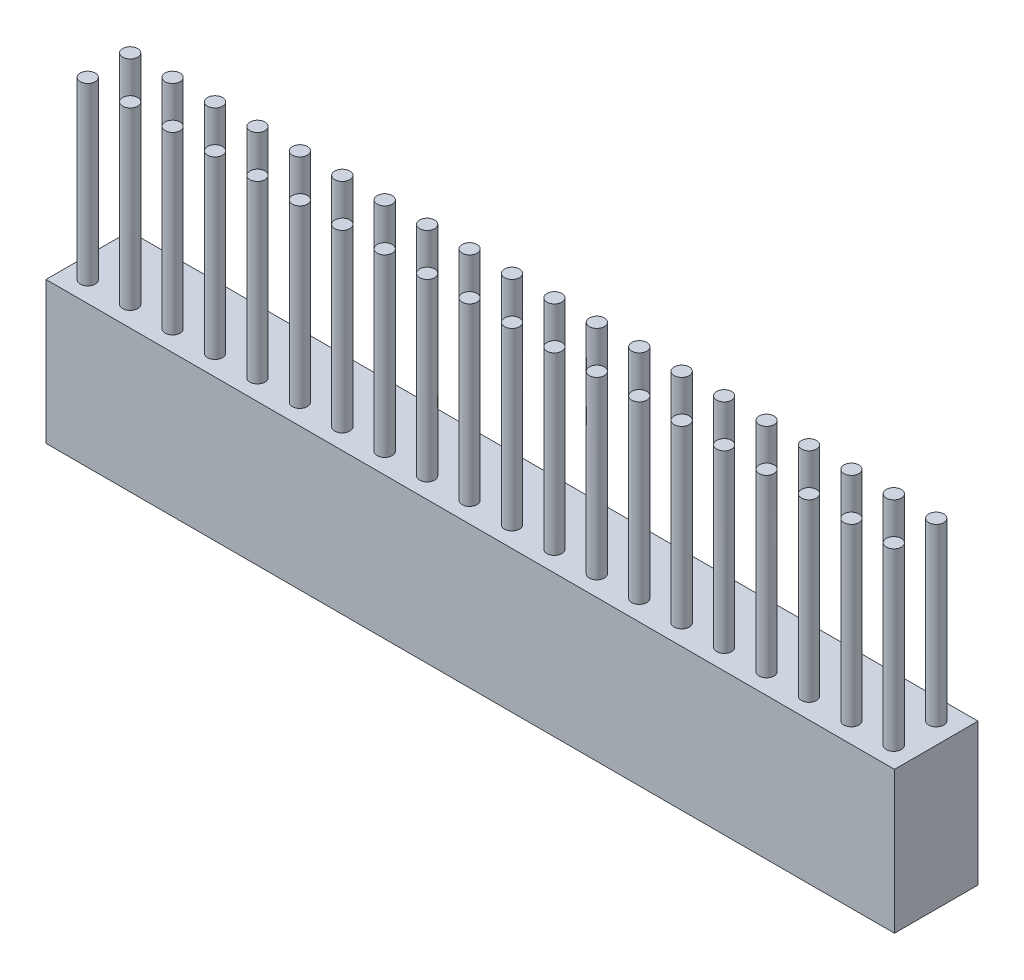
from build123d import *

# Parameters (mm, degrees)
SKETCH1_W           = 50.8
SKETCH1_H           = 5
BOSS_EXTRUDE1_DEPTH = 8.5
SKETCH2_R           = 0.449828919
BOSS_EXTRUDE2_DEPTH = 10.5
SKETCH3_W           = 1.27
SKETCH3_H           = 1.27
CUT_EXTRUDE1_DEPTH  = 5


with BuildPart() as part:
    # Sketch1 → Boss-Extrude1 (new body)
    with BuildSketch(Plane(origin=(0, 0, 0), x_dir=(1, 0, 0), z_dir=(0, 1, 0))):
        Rectangle(SKETCH1_W, SKETCH1_H)
    extrude(amount=BOSS_EXTRUDE1_DEPTH)

    # Sketch2 → Boss-Extrude2 (add)
    with BuildSketch(Plane(origin=(0, 8.5, 0), x_dir=(1, 0, 0), z_dir=(0, 1, 0))):
        with Locations(Location((-24.13, 1.27, 0), (0, 0, 90))):
            Circle(SKETCH2_R)
        with Locations(Location((-21.59, 1.27, 0), (0, 0, 90))):
            Circle(SKETCH2_R)
        with Locations(Location((-19.05, 1.27, 0), (0, 0, 90))):
            Circle(SKETCH2_R)
        with Locations(Location((-16.51, 1.27, 0), (0, 0, 90))):
            Circle(SKETCH2_R)
        with Locations(Location((-13.97, 1.27, 0), (0, 0, 90))):
            Circle(SKETCH2_R)
        with Locations(Location((-11.43, 1.27, 0), (0, 0, 90))):
            Circle(SKETCH2_R)
        with Locations(Location((-8.89, 1.27, 0), (0, 0, 90))):
            Circle(SKETCH2_R)
        with Locations(Location((-6.35, 1.27, 0), (0, 0, 90))):
            Circle(SKETCH2_R)
        with Locations(Location((-3.81, 1.27, 0), (0, 0, 90))):
            Circle(SKETCH2_R)
        with Locations(Location((-1.27, 1.27, 0), (0, 0, 90))):
            Circle(SKETCH2_R)
        with Locations(Location((1.27, 1.27, 0), (0, 0, 90))):
            Circle(SKETCH2_R)
        with Locations(Location((3.81, 1.27, 0), (0, 0, 90))):
            Circle(SKETCH2_R)
        with Locations(Location((6.35, 1.27, 0), (0, 0, 90))):
            Circle(SKETCH2_R)
        with Locations(Location((8.89, 1.27, 0), (0, 0, 90))):
            Circle(SKETCH2_R)
        with Locations(Location((11.43, 1.27, 0), (0, 0, 90))):
            Circle(SKETCH2_R)
        with Locations(Location((13.97, 1.27, 0), (0, 0, 90))):
            Circle(SKETCH2_R)
        with Locations(Location((16.51, 1.27, 0), (0, 0, 90))):
            Circle(SKETCH2_R)
        with Locations(Location((19.05, 1.27, 0), (0, 0, 90))):
            Circle(SKETCH2_R)
        with Locations(Location((21.59, 1.27, 0), (0, 0, 90))):
            Circle(SKETCH2_R)
        with Locations(Location((24.13, 1.27, 0), (0, 0, 90))):
            Circle(SKETCH2_R)
        with Locations(Location((-21.59, -1.27, 0), (0, 0, 90))):
            Circle(SKETCH2_R)
        with Locations(Location((-19.05, -1.27, 0), (0, 0, 90))):
            Circle(SKETCH2_R)
        with Locations(Location((-16.51, -1.27, 0), (0, 0, 90))):
            Circle(SKETCH2_R)
        with Locations(Location((-13.97, -1.27, 0), (0, 0, 90))):
            Circle(SKETCH2_R)
        with Locations(Location((-11.43, -1.27, 0), (0, 0, 90))):
            Circle(SKETCH2_R)
        with Locations(Location((-8.89, -1.27, 0), (0, 0, 90))):
            Circle(SKETCH2_R)
        with Locations(Location((-6.35, -1.27, 0), (0, 0, 90))):
            Circle(SKETCH2_R)
        with Locations(Location((-3.81, -1.27, 0), (0, 0, 90))):
            Circle(SKETCH2_R)
        with Locations(Location((-1.27, -1.27, 0), (0, 0, 90))):
            Circle(SKETCH2_R)
        with Locations(Location((1.27, -1.27, 0), (0, 0, 90))):
            Circle(SKETCH2_R)
        with Locations(Location((3.81, -1.27, 0), (0, 0, 90))):
            Circle(SKETCH2_R)
        with Locations(Location((6.35, -1.27, 0), (0, 0, 90))):
            Circle(SKETCH2_R)
        with Locations(Location((8.89, -1.27, 0), (0, 0, 90))):
            Circle(SKETCH2_R)
        with Locations(Location((11.43, -1.27, 0), (0, 0, 90))):
            Circle(SKETCH2_R)
        with Locations(Location((13.97, -1.27, 0), (0, 0, 90))):
            Circle(SKETCH2_R)
        with Locations(Location((16.51, -1.27, 0), (0, 0, 90))):
            Circle(SKETCH2_R)
        with Locations(Location((19.05, -1.27, 0), (0, 0, 90))):
            Circle(SKETCH2_R)
        with Locations(Location((21.59, -1.27, 0), (0, 0, 90))):
            Circle(SKETCH2_R)
        with Locations(Location((24.13, -1.27, 0), (0, 0, 90))):
            Circle(SKETCH2_R)
        with Locations(Location((-24.13, -1.27, 0), (0, 0, 90))):
            Circle(SKETCH2_R)
    extrude(amount=BOSS_EXTRUDE2_DEPTH)

    # Sketch3 → Cut-Extrude1 (cut)
    with BuildSketch(Plane.XZ):
        with Locations((-24.13, 1.280128888)):
            Rectangle(SKETCH3_W, SKETCH3_H)
        with Locations((-21.59, 1.280128888)):
            Rectangle(SKETCH3_W, SKETCH3_H)
        with Locations((-19.05, 1.280128888)):
            Rectangle(SKETCH3_W, SKETCH3_H)
        with Locations((-16.51, 1.280128888)):
            Rectangle(SKETCH3_W, SKETCH3_H)
        with Locations((-13.97, 1.280128888)):
            Rectangle(SKETCH3_W, SKETCH3_H)
        with Locations((-11.43, 1.280128888)):
            Rectangle(SKETCH3_W, SKETCH3_H)
        with Locations((-8.89, 1.280128888)):
            Rectangle(SKETCH3_W, SKETCH3_H)
        with Locations((-6.35, 1.280128888)):
            Rectangle(SKETCH3_W, SKETCH3_H)
        with Locations((-3.81, 1.280128888)):
            Rectangle(SKETCH3_W, SKETCH3_H)
        with Locations((-1.27, 1.280128888)):
            Rectangle(SKETCH3_W, SKETCH3_H)
        with Locations((1.27, 1.280128888)):
            Rectangle(SKETCH3_W, SKETCH3_H)
        with Locations((3.81, 1.280128888)):
            Rectangle(SKETCH3_W, SKETCH3_H)
        with Locations((6.35, 1.280128888)):
            Rectangle(SKETCH3_W, SKETCH3_H)
        with Locations((8.89, 1.280128888)):
            Rectangle(SKETCH3_W, SKETCH3_H)
        with Locations((11.43, 1.280128888)):
            Rectangle(SKETCH3_W, SKETCH3_H)
        with Locations((13.97, 1.280128888)):
            Rectangle(SKETCH3_W, SKETCH3_H)
        with Locations((16.51, 1.280128888)):
            Rectangle(SKETCH3_W, SKETCH3_H)
        with Locations((19.05, 1.280128888)):
            Rectangle(SKETCH3_W, SKETCH3_H)
        with Locations((21.59, 1.280128888)):
            Rectangle(SKETCH3_W, SKETCH3_H)
        with Locations((24.13, 1.280128888)):
            Rectangle(SKETCH3_W, SKETCH3_H)
        with Locations((-21.59, -1.259871112)):
            Rectangle(SKETCH3_W, SKETCH3_H)
        with Locations((-19.05, -1.259871112)):
            Rectangle(SKETCH3_W, SKETCH3_H)
        with Locations((-16.51, -1.259871112)):
            Rectangle(SKETCH3_W, SKETCH3_H)
        with Locations((-13.97, -1.259871112)):
            Rectangle(SKETCH3_W, SKETCH3_H)
        with Locations((-11.43, -1.259871112)):
            Rectangle(SKETCH3_W, SKETCH3_H)
        with Locations((-8.89, -1.259871112)):
            Rectangle(SKETCH3_W, SKETCH3_H)
        with Locations((-6.35, -1.259871112)):
            Rectangle(SKETCH3_W, SKETCH3_H)
        with Locations((-3.81, -1.259871112)):
            Rectangle(SKETCH3_W, SKETCH3_H)
        with Locations((-1.27, -1.259871112)):
            Rectangle(SKETCH3_W, SKETCH3_H)
        with Locations((1.27, -1.259871112)):
            Rectangle(SKETCH3_W, SKETCH3_H)
        with Locations((3.81, -1.259871112)):
            Rectangle(SKETCH3_W, SKETCH3_H)
        with Locations((6.35, -1.259871112)):
            Rectangle(SKETCH3_W, SKETCH3_H)
        with Locations((8.89, -1.259871112)):
            Rectangle(SKETCH3_W, SKETCH3_H)
        with Locations((11.43, -1.259871112)):
            Rectangle(SKETCH3_W, SKETCH3_H)
        with Locations((13.97, -1.259871112)):
            Rectangle(SKETCH3_W, SKETCH3_H)
        with Locations((16.51, -1.259871112)):
            Rectangle(SKETCH3_W, SKETCH3_H)
        with Locations((19.05, -1.259871112)):
            Rectangle(SKETCH3_W, SKETCH3_H)
        with Locations((21.59, -1.259871112)):
            Rectangle(SKETCH3_W, SKETCH3_H)
        with Locations((24.13, -1.259871112)):
            Rectangle(SKETCH3_W, SKETCH3_H)
        with Locations((-24.13, -1.259871112)):
            Rectangle(SKETCH3_W, SKETCH3_H)
    extrude(amount=-CUT_EXTRUDE1_DEPTH, mode=Mode.SUBTRACT)


solid = part.part
